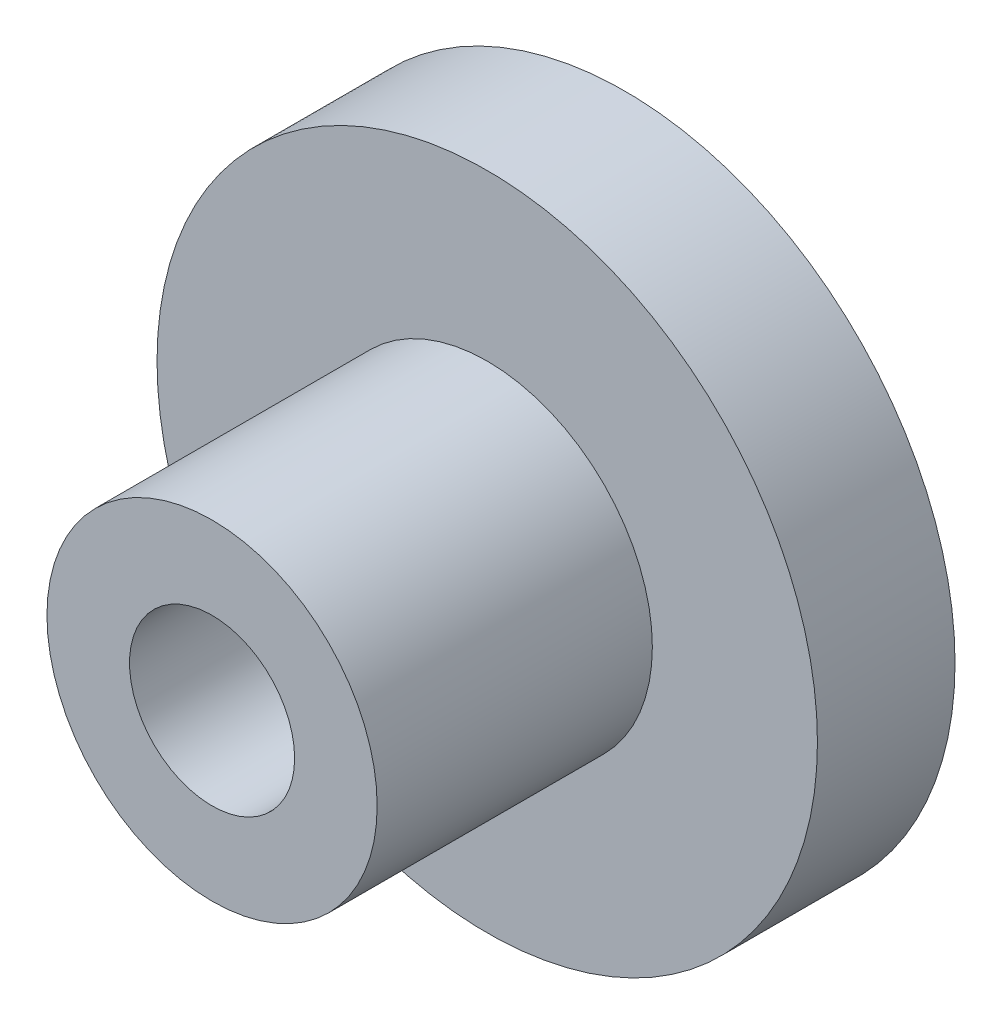
from build123d import *

# Parameters (mm, degrees)
SKETCH1_R           = 6
BOSS_EXTRUDE1_DEPTH = 2.5
SKETCH2_R           = 3
BOSS_EXTRUDE2_DEPTH = 5
SKETCH3_R           = 1.5
CUT_EXTRUDE1_DEPTH  = 12.324751653


with BuildPart() as part:
    # Sketch1 → Boss-Extrude1 (new body)
    with BuildSketch(Plane.XY):
        Circle(SKETCH1_R)
    extrude(amount=BOSS_EXTRUDE1_DEPTH)

    # Sketch2 → Boss-Extrude2 (add)
    with BuildSketch(Plane.XY.offset(2.5)):
        Circle(SKETCH2_R)
    extrude(amount=BOSS_EXTRUDE2_DEPTH)

    # Sketch3 → Cut-Extrude1 (cut, through all)
    with BuildSketch(Plane.XY.offset(7.5)):
        Circle(SKETCH3_R)
    extrude(amount=-CUT_EXTRUDE1_DEPTH, mode=Mode.SUBTRACT)


solid = part.part
